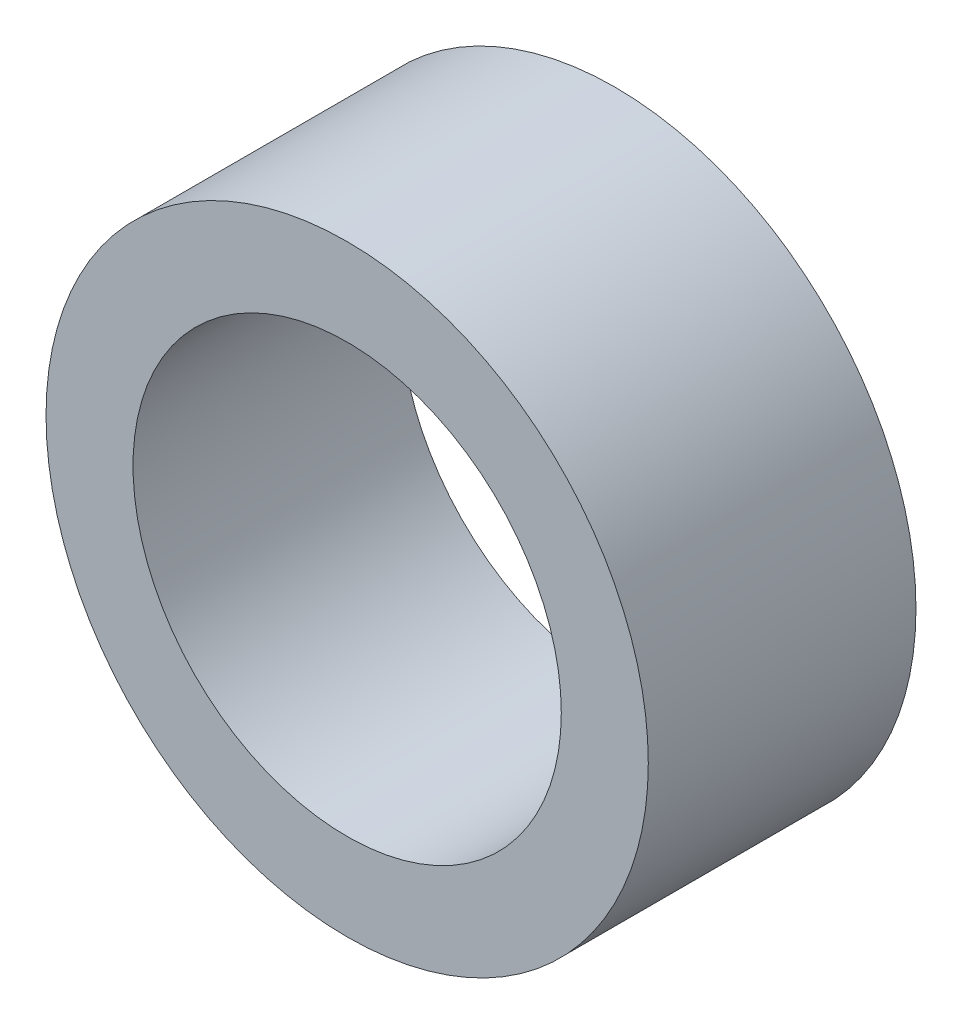
from build123d import *

# Parameters (mm, degrees)
SKETCH1_R      = 2.25
SKETCH1_R_2    = 1.6
EXTRUDE1_DEPTH = 1


with BuildPart() as part:
    # Sketch1 → Extrude1 (new, symmetric)
    with BuildSketch(Plane.XY):
        Circle(SKETCH1_R)
        Circle(SKETCH1_R_2, mode=Mode.SUBTRACT)
    extrude(amount=EXTRUDE1_DEPTH, both=True)


solid = part.part
